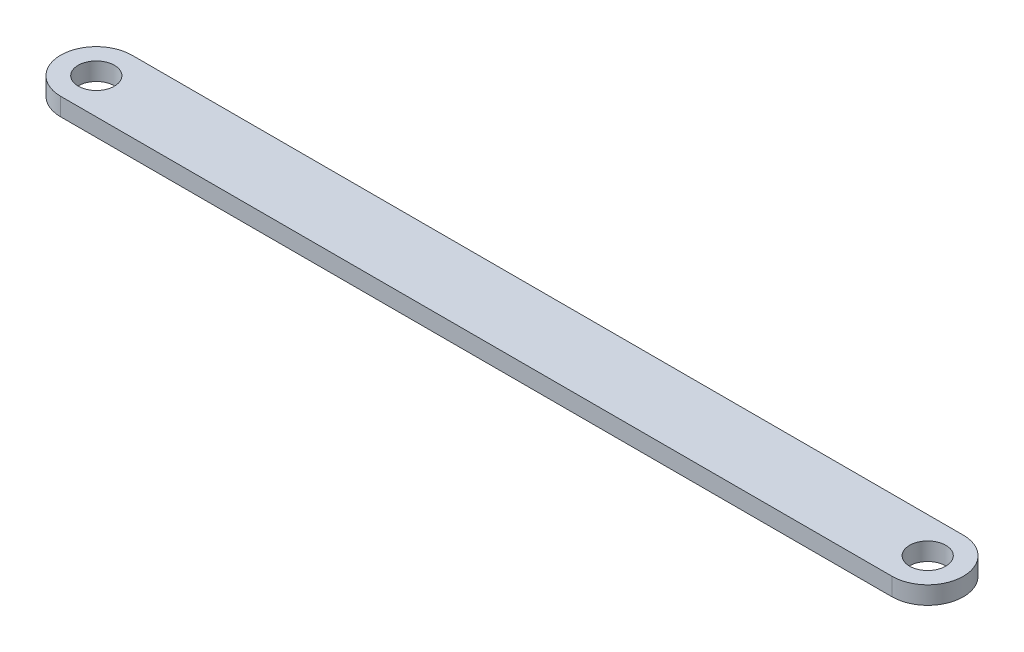
from build123d import *

# Parameters (mm, degrees)
SKETCH1_R           = 3.05
BOSS_EXTRUDE1_DEPTH = 3


with BuildPart() as part:
    # Sketch1 → Boss-Extrude1 (new body)
    with BuildSketch(Plane(origin=(0, 0, 0), x_dir=(1, 0, 0), z_dir=(0, 1, 0))):
        with BuildLine():
            Line((0, 6), (140, 6))
            ThreePointArc((140, 6), (146, 0), (140, -6))
            Line((140, -6), (0, -6))
            ThreePointArc((0, -6), (-6, 0), (0, 6))
        make_face()
        with Locations(Location((0, 0, 0), (0, 0, 270))):
            Circle(SKETCH1_R, mode=Mode.SUBTRACT)
        with Locations(Location((140, 0, 0), (0, 0, 270))):
            Circle(SKETCH1_R, mode=Mode.SUBTRACT)
    extrude(amount=BOSS_EXTRUDE1_DEPTH)


solid = part.part
